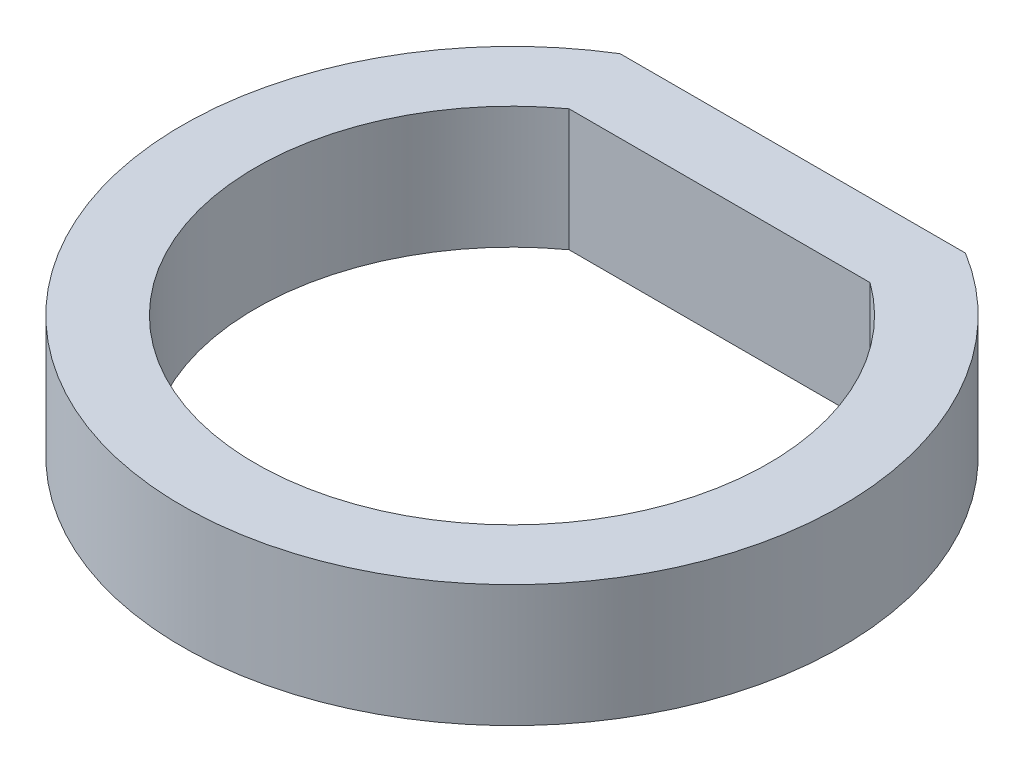
from build123d import *

# Parameters (mm, degrees)
BOSS_EXTRU_2_DEPTH = 5


with BuildPart() as part:
    # Esquisse2 → Boss.-Extru.2 (new body)
    with BuildSketch(Plane(origin=(0, 0, 0), x_dir=(1, 0, 0), z_dir=(0, 1, 0))):
        with BuildLine():
            ThreePointArc((-19.751463333, 34.064312188), (-23.703099364, 14.770083553), (-4.195114147, 12.064312188))
            ThreePointArc((-4.195114147, 12.064312188), (0.791798064, 23.430337591), (-5.609327709, 34.064312188))
            Line((-5.609327709, 34.064312188), (-19.751463333, 34.064312188))
        make_face()
        with BuildLine():
            Line((-18.844809524, 31.064312188), (-6.515981518, 31.064312188))
            ThreePointArc((-6.515981518, 31.064312188), (-2.692903343, 19.323941838), (-12.680395521, 12.064312188))
            ThreePointArc((-12.680395521, 12.064312188), (-22.667887699, 19.323941838), (-18.844809524, 31.064312188))
        make_face(mode=Mode.SUBTRACT)
    extrude(amount=BOSS_EXTRU_2_DEPTH)


solid = part.part
